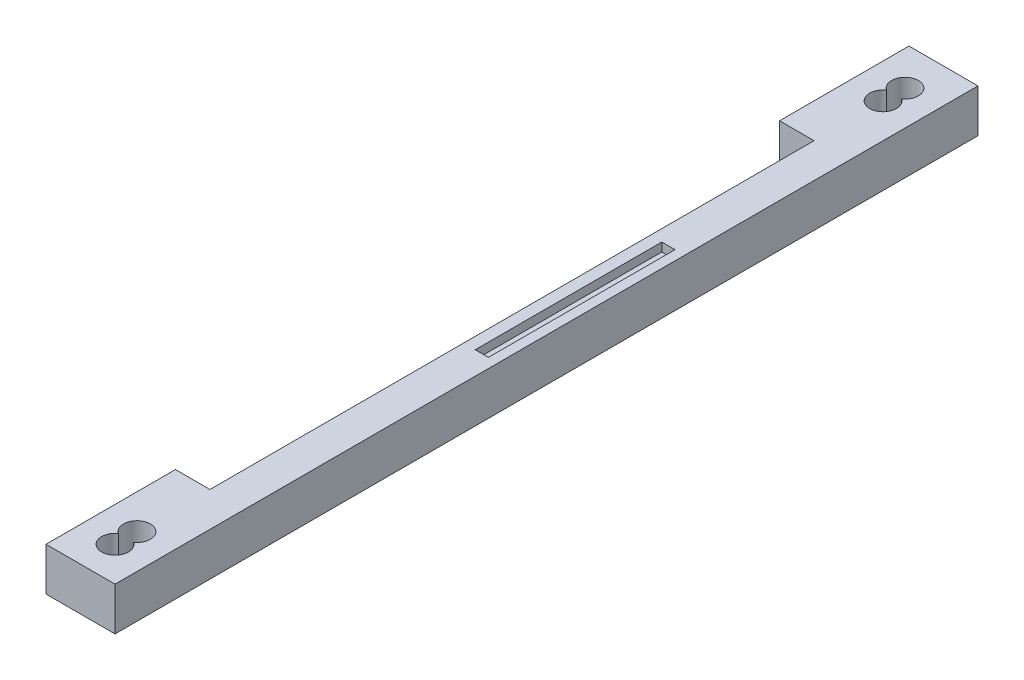
from build123d import *

# Parameters (mm, degrees)
SKETCH1_W      = 8
SKETCH1_H      = 100
EXTRUDE1_DEPTH = 5
SKETCH2_R      = 1.55
EXTRUDE4_DEPTH = 5
SKETCH4_R      = 1.55
EXTRUDE6_DEPTH = 5
SKETCH5_W      = 4
SKETCH5_H      = 70
EXTRUDE7_DEPTH = 5
SKETCH6_W      = 1.530516358
SKETCH6_H      = 21.618543552
EXTRUDE8_DEPTH = 1


with BuildPart() as part:
    # Sketch1 → Extrude1 (new body)
    with BuildSketch(Plane(origin=(0, 0, 0), x_dir=(1, 0, 0), z_dir=(0, 1, 0))):
        Rectangle(SKETCH1_W, SKETCH1_H)
    extrude(amount=EXTRUDE1_DEPTH)

    # Sketch2 → Extrude4 (cut)
    with BuildSketch(Plane(origin=(0, 5, 0), x_dir=(1, 0, 0), z_dir=(0, 1, 0))):
        with Locations(Location((0, -46, 0), (0, 0, 270))):
            Circle(SKETCH2_R)
    extrude(amount=-EXTRUDE4_DEPTH, mode=Mode.SUBTRACT)

    # Sketch4 → Extrude6 (cut)
    with BuildSketch(Plane(origin=(0, 5, 0), x_dir=(1, 0, 0), z_dir=(0, 1, 0))):
        with Locations((0, -43.46)):
            Circle(SKETCH4_R)
        with Locations((0, -46)):
            Circle(SKETCH4_R)
        with Locations((0, 43)):
            Circle(SKETCH4_R)
        with Locations((0, 45.54)):
            Circle(SKETCH4_R)
    extrude(amount=-EXTRUDE6_DEPTH, mode=Mode.SUBTRACT)

    # Sketch5 → Extrude7 (cut)
    with BuildSketch(Plane(origin=(0, 5, 0), x_dir=(1, 0, 0), z_dir=(0, 1, 0))):
        with Locations((-2, 0)):
            Rectangle(SKETCH5_W, SKETCH5_H)
    extrude(amount=-EXTRUDE7_DEPTH, mode=Mode.SUBTRACT)

    # Sketch6 → Extrude8 (cut)
    with BuildSketch(Plane(origin=(0, 5, 0), x_dir=(1, 0, 0), z_dir=(0, 1, 0))):
        with Locations((2.112618746, 5.201364346)):
            Rectangle(SKETCH6_W, SKETCH6_H)
    extrude(amount=-EXTRUDE8_DEPTH, mode=Mode.SUBTRACT)


solid = part.part
